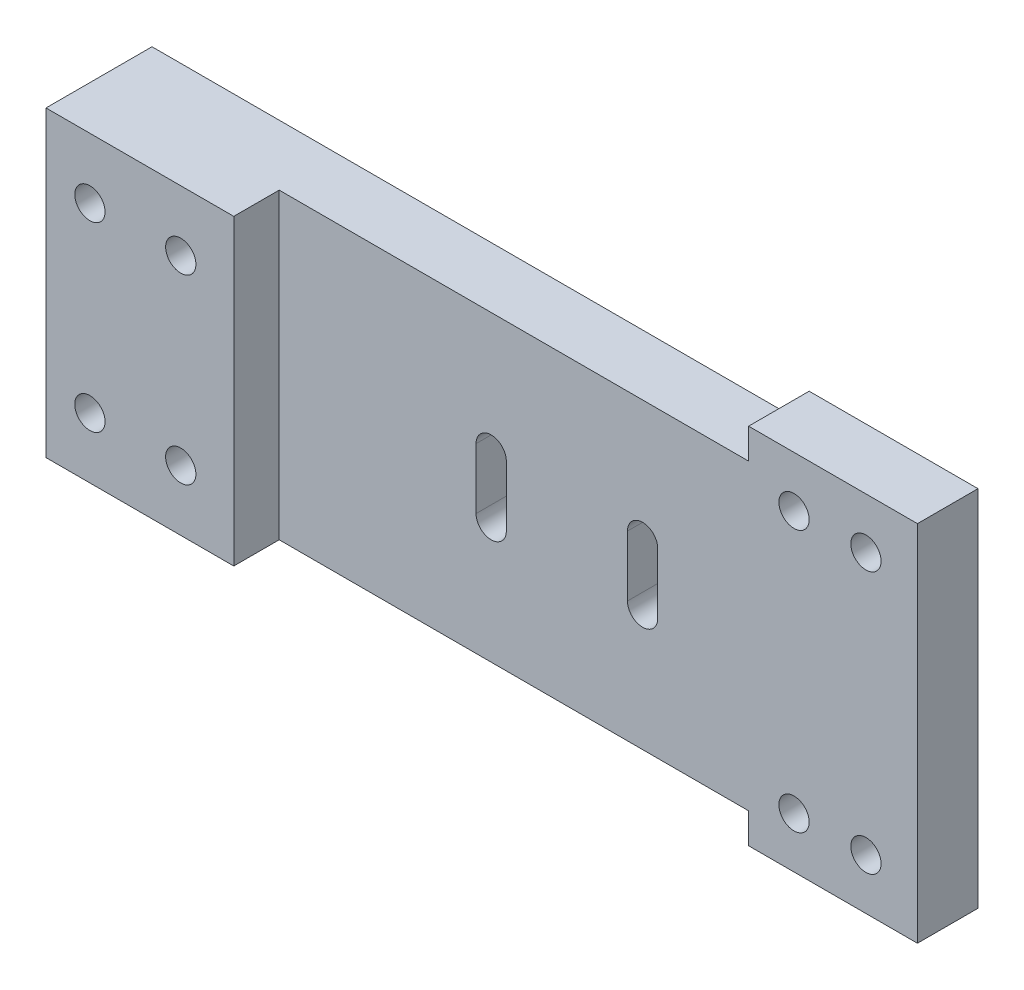
from build123d import *

# Parameters (mm, degrees)
SKETCH1_W           = 109.1
SKETCH1_H           = 40
BOSS_EXTRUDE1_DEPTH = 8
SKETCH2_W           = 22.3
SKETCH2_H           = 48
BOSS_EXTRUDE2_DEPTH = 8
SKETCH3_W           = 24.8
SKETCH3_H           = 40
BOSS_EXTRUDE3_DEPTH = 6
SKETCH4_R           = 2
CUT_EXTRUDE1_DEPTH  = 6.7
SKETCH5_R           = 2
CUT_EXTRUDE2_DEPTH  = 6.7
SKETCH6_R           = 2
CUT_EXTRUDE3_DEPTH  = 6.7


with BuildPart() as part:
    # Sketch1 → Boss-Extrude1 (new body)
    with BuildSketch(Plane.XY.offset(246)):
        with Locations((281.75, 300)):
            Rectangle(SKETCH1_W, SKETCH1_H)
        with BuildLine():
            Line((282, 296), (282, 304))
            ThreePointArc((282, 304), (280, 306), (278, 304))
            Line((278, 304), (278, 296))
            ThreePointArc((278, 296), (280, 294), (282, 296))
        make_face(mode=Mode.SUBTRACT)
        with BuildLine():
            Line((302, 296), (302, 304))
            ThreePointArc((302, 304), (300, 306), (298, 304))
            Line((298, 304), (298, 296))
            ThreePointArc((298, 296), (300, 294), (302, 296))
        make_face(mode=Mode.SUBTRACT)
    extrude(amount=BOSS_EXTRUDE1_DEPTH)

    # Sketch2 → Boss-Extrude2 (add)
    with BuildSketch(Plane.XY.offset(246)):
        with Locations((325.15, 300)):
            Rectangle(SKETCH2_W, SKETCH2_H)
    extrude(amount=BOSS_EXTRUDE2_DEPTH)

    # Sketch3 → Boss-Extrude3 (add)
    with BuildSketch(Plane.XY.offset(254)):
        with Locations((239.6, 300)):
            Rectangle(SKETCH3_W, SKETCH3_H)
    extrude(amount=BOSS_EXTRUDE3_DEPTH)

    # Sketch4 → Cut-Extrude1 (cut)
    with BuildSketch(Plane.XY.offset(253.3)):
        with Locations((233, 288)):
            Circle(SKETCH4_R)
        with Locations((233, 312)):
            Circle(SKETCH4_R)
        with Locations((245, 288)):
            Circle(SKETCH4_R)
        with Locations((245, 312)):
            Circle(SKETCH4_R)
    extrude(amount=CUT_EXTRUDE1_DEPTH, mode=Mode.SUBTRACT)

    # Sketch5 → Cut-Extrude2 (cut)
    with BuildSketch(Plane.XY.offset(247.3)):
        with Locations((320, 282.7)):
            Circle(SKETCH5_R)
        with Locations((320, 317.3)):
            Circle(SKETCH5_R)
        with Locations((329.5, 282.7)):
            Circle(SKETCH5_R)
        with Locations((329.5, 317.3)):
            Circle(SKETCH5_R)
    extrude(amount=CUT_EXTRUDE2_DEPTH, mode=Mode.SUBTRACT)

    # Sketch6 → Cut-Extrude3 (cut)
    with BuildSketch(Plane.XY.offset(246)):
        with Locations((238, 294)):
            Circle(SKETCH6_R)
        with Locations((238, 306)):
            Circle(SKETCH6_R)
        with Locations((326, 292)):
            Circle(SKETCH6_R)
        with Locations((326, 308)):
            Circle(SKETCH6_R)
    extrude(amount=CUT_EXTRUDE3_DEPTH, mode=Mode.SUBTRACT)


solid = part.part
